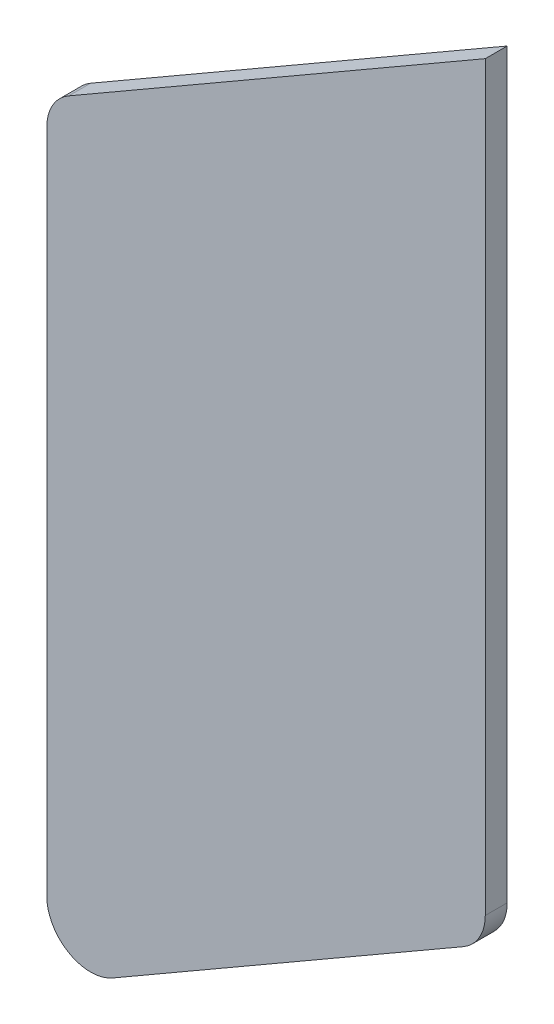
from build123d import *

# Parameters (mm, degrees)
BOSS_EXTRU_1_DEPTH = 5


with BuildPart() as part:
    # Esquisse1 → Boss.-Extru.1 (new body)
    with BuildSketch(Plane.XY):
        with BuildLine():
            Line((47.5, 139.461524227), (47.5, -29.764973081))
            ThreePointArc((47.5, -29.764973081), (46.160254038, -34.764973081), (42.5, -38.425227119))
            Line((42.5, -38.425227119), (-37.5, -84.613248654))
            ThreePointArc((-37.5, -84.613248654), (-47.5, -84.613248654), (-52.5, -75.952994616))
            Line((-52.5, -75.952994616), (-52.5, 75.952994616))
            ThreePointArc((-52.5, 75.952994616), (-51.160254038, 80.952994616), (-47.5, 84.613248654))
            Line((-47.5, 84.613248654), (47.5, 139.461524227))
        make_face()
    extrude(amount=BOSS_EXTRU_1_DEPTH)


solid = part.part
